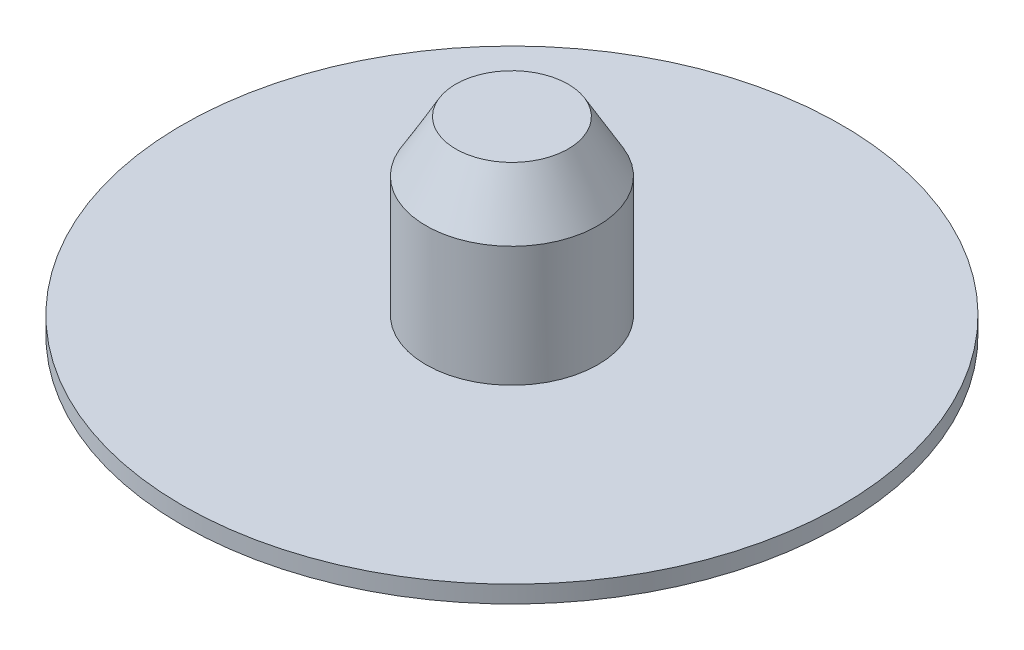
from build123d import *

# Parameters (mm, degrees)
SKETCH1_R           = 5.75
BOSS_EXTRUDE1_DEPTH = 0.3
SKETCH2_R           = 1.5
BOSS_EXTRUDE2_DEPTH = 3
CHAMFER1_SIZE       = 0.9
CHAMFER1_SIZE2      = 0.519615242


with BuildPart() as part:
    # Sketch1 → Boss-Extrude1 (new body)
    with BuildSketch(Plane(origin=(0, 0, 0), x_dir=(1, 0, 0), z_dir=(0, 1, 0))):
        with Locations(Location((0, 0, 0), (0, 0, 270))):
            Circle(SKETCH1_R)
    extrude(amount=BOSS_EXTRUDE1_DEPTH)

    # Sketch2 → Boss-Extrude2 (add)
    with BuildSketch(Plane(origin=(0, 0.3, 0), x_dir=(1, 0, 0), z_dir=(0, 1, 0))):
        with Locations(Location((0, 0, 0), (0, 0, 270))):
            Circle(SKETCH2_R)
    extrude(amount=BOSS_EXTRUDE2_DEPTH)

    # Chamfer1
    chamfer1_edges = [part.edges().sort_by_distance(p)[0] for p in [
        (0, 3.3, -1.5),
    ]]
    chamfer1_side = [part.faces().sort_by_distance(p)[0] for p in [
        (0, 1.8, -1.5),
    ]]
    chamfer(chamfer1_edges, length=CHAMFER1_SIZE, length2=CHAMFER1_SIZE2, reference=chamfer1_side[0])


solid = part.part
